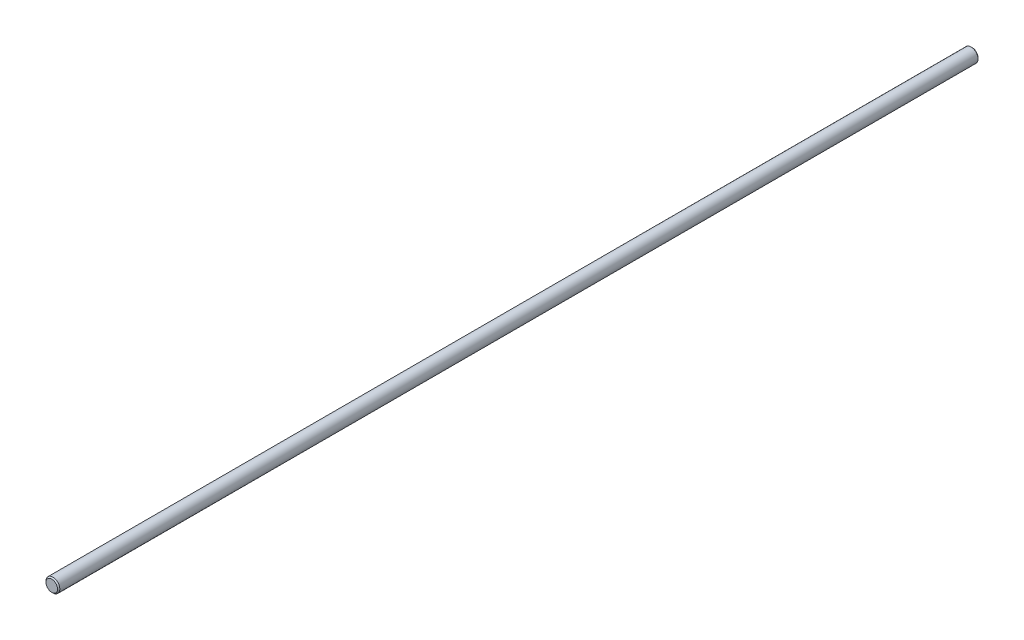
from build123d import *

# Parameters (mm, degrees)
SKETCH_1_R      = 3
EXTRUDE_1_DEPTH = 200
CHAMFER_1_SIZE  = 0.5


with BuildPart() as part:
    # 草图1 → 凸台-拉伸1 (new, symmetric)
    with BuildSketch(Plane.XY):
        Circle(SKETCH_1_R)
    extrude(amount=EXTRUDE_1_DEPTH, both=True)

    # 倒角1
    chamfer_1_edges = [part.edges().sort_by_distance(p)[0] for p in [
        (-3, 0, -200),
        (-3, 0, 200),
    ]]
    chamfer(chamfer_1_edges, length=CHAMFER_1_SIZE)


solid = part.part
